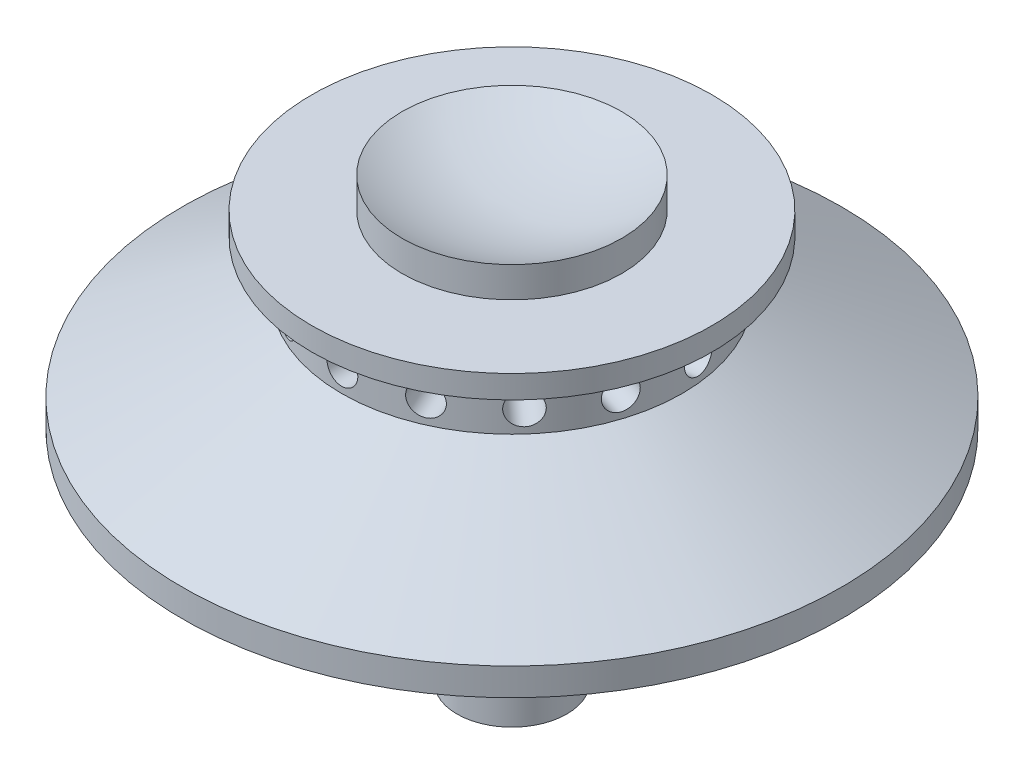
from build123d import *

# Parameters (mm, degrees)
CIRPATTERN1_COUNT = 15
SKETCH3_R         = 6.35
EXTRUDE1_DEPTH    = 25.4


with BuildPart() as part:
    # Sketch1 → Revolve1 (revolve)
    with BuildSketch(Plane.XY, mode=Mode.PRIVATE) as revolve1_sk:
        with BuildLine():
            Line((0, 0), (-38.1, 0))
            Line((-38.1, 0), (-38.1, 3.175))
            Line((-38.1, 3.175), (-19.683026774, 13.355449774))
            Line((-19.683026774, 13.355449774), (-19.683026774, 19.225285171))
            Line((-19.683026774, 19.225285171), (-23.130794131, 19.225285171))
            Line((-23.130794131, 19.225285171), (-23.130794131, 21.874102239))
            Line((-23.130794131, 21.874102239), (-12.7, 21.874102239))
            Line((-12.7, 21.874102239), (-12.7, 25.4))
            ThreePointArc((-12.7, 25.4), (-6.545430181, 23.030779277), (0, 22.225))
            Line((0, 22.225), (0, 0))
        make_face()
    revolve(revolve1_sk.sketch.rotate(Axis((0, 22.225, 0), (0, 1, 0)), 270), axis=Axis((0, 22.225, 0), (0, 1, 0)))

    # Sketch2 → 9/64 (0.14063) Diameter Hole1 (revolve, cut)
    with BuildSketch(Plane(origin=(0, 15.875, 19.683026774), x_dir=(0, -1, 0), z_dir=(1, 0, 0))):
        Polygon((0, 0), (0, 13.773137666), (1.786001, 12.7), (1.786001, 0), align=None)
    f_9_64_0_14063_diameter_hole1 = revolve(axis=Axis((0, 15.875, 26.033026774), (0, 0, -1)), mode=Mode.SUBTRACT)

    # CirPattern1: 9/64 (0.14063) Diameter Hole1 ×15 about axis
    cirpattern1_axis = Axis((0, 22.225, 0), (0, 1, 0))
    for i in range(1, CIRPATTERN1_COUNT):
        add(f_9_64_0_14063_diameter_hole1.rotate(cirpattern1_axis, i * 360 / CIRPATTERN1_COUNT), mode=Mode.SUBTRACT)

    # Sketch3 → Extrude1 (add)
    with BuildSketch(Plane.XZ):
        with Locations(Location((0, 0, 0), (0, 0, 90))):
            Circle(SKETCH3_R)
    extrude(amount=EXTRUDE1_DEPTH)


solid = part.part
